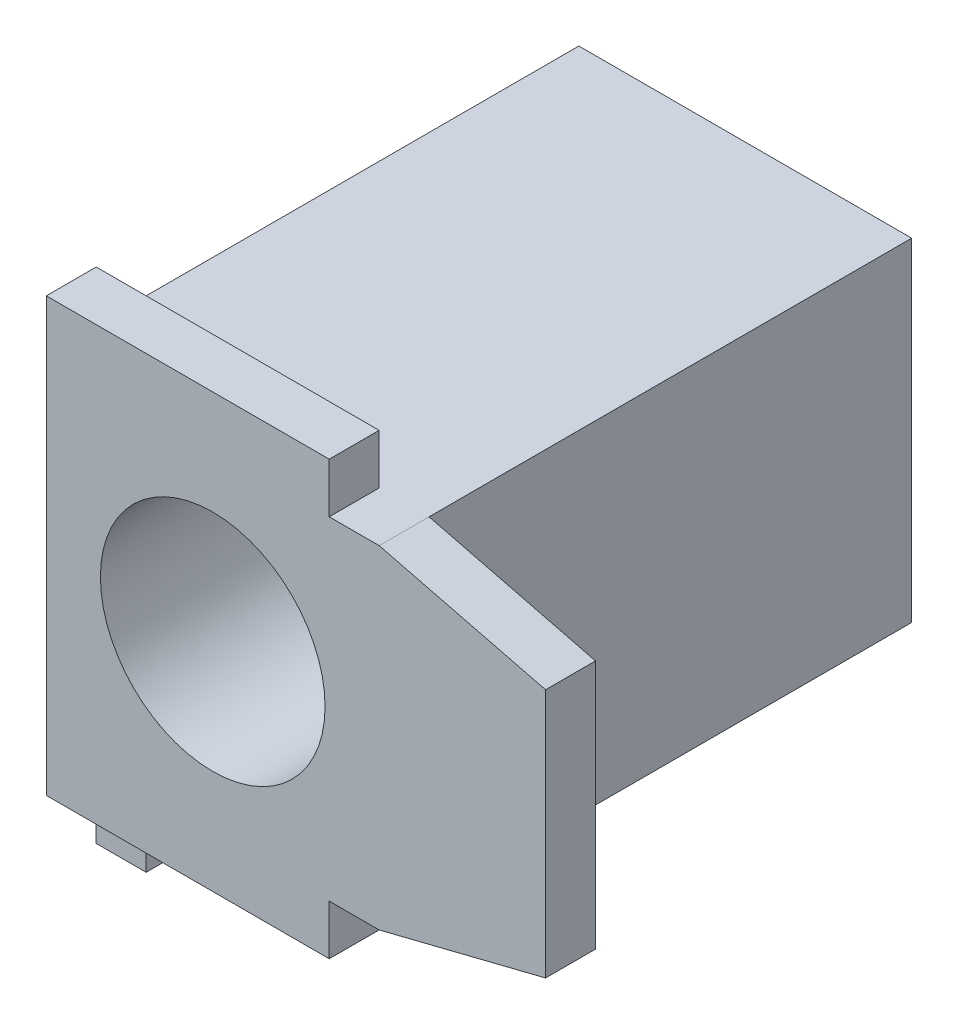
from build123d import *

# Parameters (mm, degrees)
SKETCH_1_W          = 20
SKETCH_1_H          = 20
SKETCH_1_R          = 6.75
EXTRUDE_1_DEPTH     = 27
SKETCH_2_W          = 20
SKETCH_2_H          = 20
SKETCH_2_R          = 1.5
EXTRUDE_2_DEPTH     = 5
SKETCH_3_W          = 3
SKETCH_3_H          = 20
EXTRUDE_3_DEPTH     = 10
CUT_EXTRUDE_1_DEPTH = 10
SKETCH_5_W          = 17
SKETCH_5_H          = 3
EXTRUDE_4_DEPTH     = 3
SKETCH_7_W          = 29
SKETCH_7_H          = 7
EXTRUDE_5_DEPTH     = 3
SKETCH_8_R          = 2
CUT_EXTRUDE_2_DEPTH = 10


with BuildPart() as part:
    # 草图1 → 凸台-拉伸1 (new body)
    with BuildSketch(Plane.XY):
        Rectangle(SKETCH_1_W, SKETCH_1_H)
        Circle(SKETCH_1_R, mode=Mode.SUBTRACT)
    extrude(amount=EXTRUDE_1_DEPTH)

    # 草图2 → 凸台-拉伸2 (add)
    with BuildSketch(Plane(origin=(0, 0, 0), x_dir=(-1, 0, 0), z_dir=(0, 0, -1))):
        Rectangle(SKETCH_2_W, SKETCH_2_H)
        Circle(SKETCH_2_R, mode=Mode.SUBTRACT)
    extrude(amount=EXTRUDE_2_DEPTH)

    # 草图3 → 凸台-拉伸3 (add)
    with BuildSketch(Plane(origin=(10, 0, 0), x_dir=(0, 0, -1), z_dir=(1, 0, 0))):
        with Locations((-25.5, 0)):
            Rectangle(SKETCH_3_W, SKETCH_3_H)
    extrude(amount=EXTRUDE_3_DEPTH)

    # 草图4 → 切除-拉伸1 (cut)
    with BuildSketch(Plane(origin=(0, 0, 24), x_dir=(-1, 0, 0), z_dir=(0, 0, -1))):
        Polygon((-20, 7.5), (-10, 10), (-20, 10), align=None)
    cut_extrude_1 = extrude(amount=-CUT_EXTRUDE_1_DEPTH, mode=Mode.SUBTRACT)

    # 镜向1: 切除-拉伸1 across plane
    add(cut_extrude_1.mirror(Plane.ZX), mode=Mode.SUBTRACT)

    # 草图5 → 凸台-拉伸4 (add)
    with BuildSketch(Plane(origin=(0, 10, 0), x_dir=(1, 0, 0), z_dir=(0, 1, 0))):
        with Locations((-1.5, -25.5)):
            Rectangle(SKETCH_5_W, SKETCH_5_H)
    extrude_4 = extrude(amount=EXTRUDE_4_DEPTH)

    # 镜向2: 凸台-拉伸4 across plane
    add(extrude_4.mirror(Plane.ZX))

    # 草图7 → 凸台-拉伸5 (add)
    with BuildSketch(Plane.ZY.offset(10)):
        with Locations((9.5, -13.5)):
            Rectangle(SKETCH_7_W, SKETCH_7_H)
    extrude(amount=-EXTRUDE_5_DEPTH)

    # 草图8 → 切除-拉伸2 (cut)
    with BuildSketch(Plane.ZY.offset(10)):
        with Locations(Location((19, -13, 0), (0, 0, 270))):
            Circle(SKETCH_8_R)
        with Locations(Location((-1, -13, 0), (0, 0, 270))):
            Circle(SKETCH_8_R)
    extrude(amount=-CUT_EXTRUDE_2_DEPTH, mode=Mode.SUBTRACT)


solid = part.part
